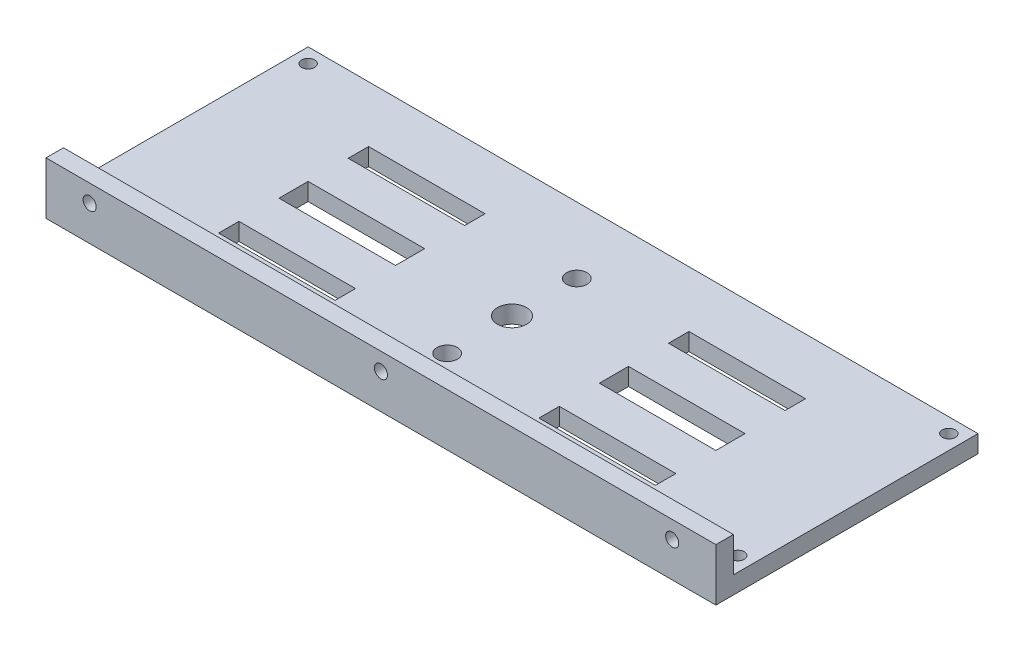
from build123d import *

# Parameters (mm, degrees)
SKETCH1_W           = 230
SKETCH1_H           = 90
SKETCH1_R           = 5
SKETCH1_R_2         = 3.5
SKETCH1_R_3         = 2.25
SKETCH1_W_2         = 40
SKETCH1_H_2         = 10
SKETCH1_H_3         = 7
BOSS_EXTRUDE1_DEPTH = 6
SKETCH2_W           = 230
SKETCH2_H           = 6
BOSS_EXTRUDE2_DEPTH = 12
CUT_EXTRUDE1_REACH  = 145.544
SKETCH3_R           = 2.25


with BuildPart() as part:
    # Sketch1 → Boss-Extrude1 (new body)
    with BuildSketch(Plane(origin=(0, 0, 0), x_dir=(1, 0, 0), z_dir=(0, 1, 0))):
        Rectangle(SKETCH1_W, SKETCH1_H)
        with Locations(Location((0, 0, 0), (0, 0, 270))):
            Circle(SKETCH1_R, mode=Mode.SUBTRACT)
        with Locations(Location((0, 22.25, 0), (0, 0, 270))):
            Circle(SKETCH1_R_2, mode=Mode.SUBTRACT)
        with Locations(Location((0, -22.25, 0), (0, 0, 90))):
            Circle(SKETCH1_R_2, mode=Mode.SUBTRACT)
        with Locations(Location((110, 40, 0), (0, 0, 270))):
            Circle(SKETCH1_R_3, mode=Mode.SUBTRACT)
        with Locations(Location((110, -32.5, 0), (0, 0, 270))):
            Circle(SKETCH1_R_3, mode=Mode.SUBTRACT)
        with Locations(Location((-110, 40, 0), (0, 0, 90))):
            Circle(SKETCH1_R_3, mode=Mode.SUBTRACT)
        with Locations(Location((-110, -32.5, 0), (0, 0, 90))):
            Circle(SKETCH1_R_3, mode=Mode.SUBTRACT)
        with Locations((55, 0)):
            Rectangle(SKETCH1_W_2, SKETCH1_H_2, mode=Mode.SUBTRACT)
        with Locations((55, 22.25)):
            Rectangle(SKETCH1_W_2, SKETCH1_H_3, mode=Mode.SUBTRACT)
        with Locations((55, -22.25)):
            Rectangle(SKETCH1_W_2, SKETCH1_H_3, mode=Mode.SUBTRACT)
        with Locations((-55, -22.25)):
            Rectangle(SKETCH1_W_2, SKETCH1_H_3, mode=Mode.SUBTRACT)
        with Locations((-55, 0)):
            Rectangle(SKETCH1_W_2, SKETCH1_H_2, mode=Mode.SUBTRACT)
        with Locations((-55, 22.25)):
            Rectangle(SKETCH1_W_2, SKETCH1_H_3, mode=Mode.SUBTRACT)
    extrude(amount=BOSS_EXTRUDE1_DEPTH)

    # Sketch2 → Boss-Extrude2 (add)
    with BuildSketch(Plane(origin=(0, 6, 0), x_dir=(1, 0, 0), z_dir=(0, 1, 0))):
        with Locations((0, -42)):
            Rectangle(SKETCH2_W, SKETCH2_H)
    extrude(amount=BOSS_EXTRUDE2_DEPTH)

    # Sketch3 → Cut-Extrude1 (cut, up to next)
    with BuildSketch(Plane(origin=(0, 0, 39), x_dir=(-1, 0, 0), z_dir=(0, 0, -1)), mode=Mode.PRIVATE) as cut_extrude1_sk1:
        with Locations((0, 12)):
            Circle(SKETCH3_R)
    cut_extrude1_tool1 = extrude(cut_extrude1_sk1.sketch, amount=-CUT_EXTRUDE1_REACH, mode=Mode.PRIVATE) & part.part
    # Sketch3 → Cut-Extrude1 (cut, up to next)
    with BuildSketch(Plane(origin=(0, 0, 39), x_dir=(-1, 0, 0), z_dir=(0, 0, -1)), mode=Mode.PRIVATE) as cut_extrude1_sk2:
        with Locations((100, 12)):
            Circle(SKETCH3_R)
    cut_extrude1_tool2 = extrude(cut_extrude1_sk2.sketch, amount=-CUT_EXTRUDE1_REACH, mode=Mode.PRIVATE) & part.part
    # Sketch3 → Cut-Extrude1 (cut, up to next)
    with BuildSketch(Plane(origin=(0, 0, 39), x_dir=(-1, 0, 0), z_dir=(0, 0, -1)), mode=Mode.PRIVATE) as cut_extrude1_sk3:
        with Locations((-100, 12)):
            Circle(SKETCH3_R)
    cut_extrude1_tool3 = extrude(cut_extrude1_sk3.sketch, amount=-CUT_EXTRUDE1_REACH, mode=Mode.PRIVATE) & part.part
    add(cut_extrude1_tool1.solids().sort_by_distance((0, 12, 39))[0], mode=Mode.SUBTRACT)
    add(cut_extrude1_tool2.solids().sort_by_distance((-100, 12, 39))[0], mode=Mode.SUBTRACT)
    add(cut_extrude1_tool3.solids().sort_by_distance((100, 12, 39))[0], mode=Mode.SUBTRACT)


solid = part.part
